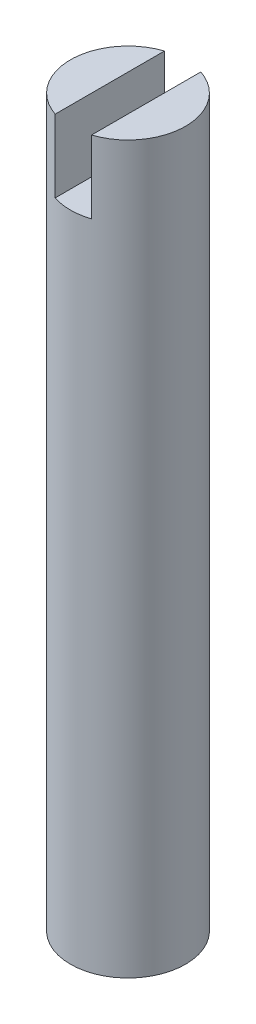
from build123d import *

# Parameters (mm, degrees)
SKETCH1_R           = 1.587
BOSS_EXTRUDE1_DEPTH = 20
CUT_EXTRUDE1_START  = -2
CUT_EXTRUDE1_DEPTH  = 2


with BuildPart() as part:
    # Sketch1 → Boss-Extrude1 (new body)
    with BuildSketch(Plane(origin=(0, 0, 0), x_dir=(1, 0, 0), z_dir=(0, 1, 0))):
        with Locations(Location((0, 0, 0), (0, 0, 270))):
            Circle(SKETCH1_R)
    extrude(amount=BOSS_EXTRUDE1_DEPTH)

    # Sketch2 → Cut-Extrude1 (cut)
    with BuildSketch(Plane(origin=(0, 20, 0), x_dir=(1, 0, 0), z_dir=(0, 1, 0)).offset(CUT_EXTRUDE1_START)):
        with BuildLine():
            ThreePointArc((0.5, 1.506176948), (0.253245121, 1.566663942), (0, 1.587))
            ThreePointArc((0, 1.587), (-0.253245121, 1.566663942), (-0.5, 1.506176948))
            Line((-0.5, 1.506176948), (-0.5, -1.506176948))
            ThreePointArc((-0.5, -1.506176948), (-0.253245121, -1.566663942), (0, -1.587))
            ThreePointArc((0, -1.587), (0.253245121, -1.566663942), (0.5, -1.506176948))
            Line((0.5, -1.506176948), (0.5, 1.506176948))
        make_face()
    extrude(amount=CUT_EXTRUDE1_DEPTH, mode=Mode.SUBTRACT)


solid = part.part
